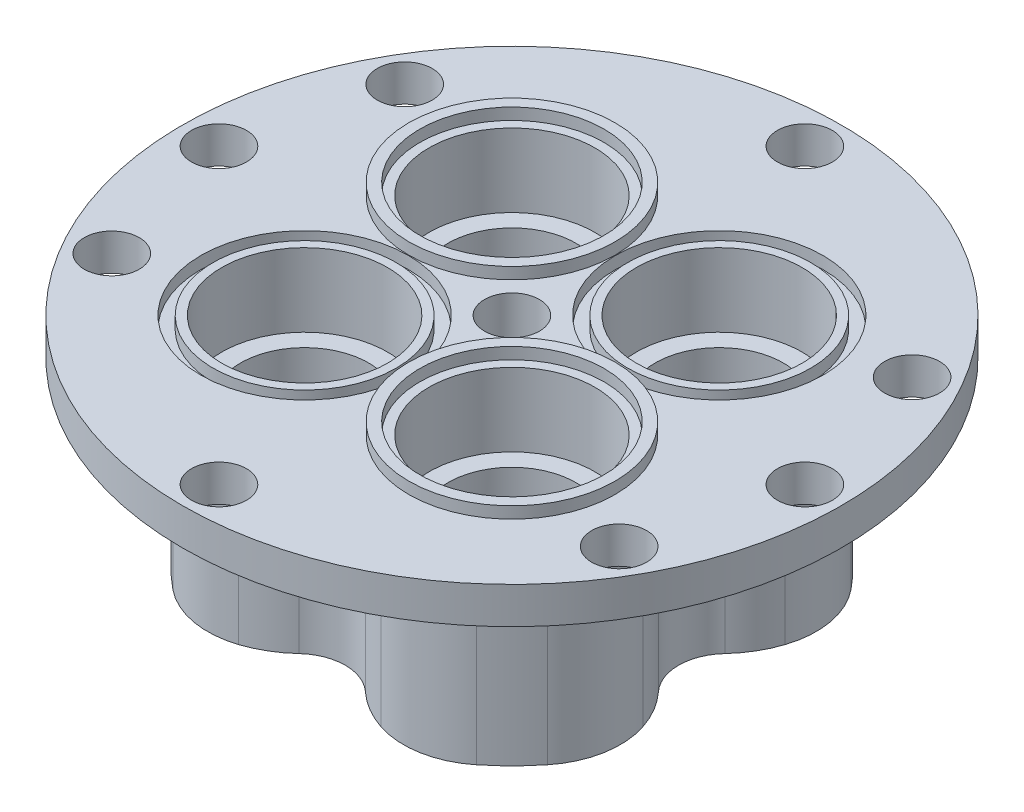
from build123d import *

# Parameters (mm, degrees)
SKETCH1_R                                        = 20.5
BOSS_EXTRUDE1_DEPTH                              = 18
SKETCH3_R                                        = 5.25
CUT_EXTRUDE1_M12_TAP_DRILL_DEPTH                 = 15
SKETCH4_R                                        = 6.7945
CUT_EXTRUDE2_RETAINING_RING_THREADS_DEPTH        = 6
CUT_EXTRUDE10_DEPTH                              = 35.124771062
CUT_EXTRUDE10_DEPTH_BACK                         = 9
SKETCH20_R                                       = 6
SKETCH7_R                                        = 8.45
SKETCH7_R_2                                      = 7.55
EXTRUDE_THIN1_DEPTH                              = 0.95
SKETCH8_R                                        = 8.5
SKETCH8_R_2                                      = 7.5
CUT_EXTRUDE_THIN1_DEPTH                          = 1
BOSS_EXTRUDE2_START                              = 3
SKETCH10_R                                       = 27
SKETCH10_R_2                                     = 20.5
BOSS_EXTRUDE2_DEPTH                              = 3
SKETCH11_R                                       = 2.25
CUT_EXTRUDE3_OLAF_MOUNTING_HOLES_M3_C_DEPTH      = 10
CUT_EXTRUDE9_BFG_MOUNTING_HOLES_M4_CL_DEPTH      = 43.627485265
CUT_EXTRUDE9_BFG_MOUNTING_HOLES_M4_CL_DEPTH_BACK = 43.627485265
SKETCH19_R                                       = 2.25
CUT_EXTRUDE5_DEPTH                               = 15
SKETCH16_R                                       = 26.810322774
SKETCH16_R_2                                     = 19.75
CUT_EXTRUDE6_FOR_BFG_FIT_DEPTH                   = 42.024382994
SKETCH12_R                                       = 2.25
CUT_EXTRUDE4_8_32_CLEARANCE_DEPTH                = 43.627485265
FILLET1_R                                        = 7


with BuildPart() as part:
    # Sketch1 → Boss-Extrude1 (new body)
    with BuildSketch(Plane(origin=(0, 0, 0), x_dir=(1, 0, 0), z_dir=(0, 1, 0))):
        with Locations(Location((0, 0, 0), (0, 0, 270))):
            Circle(SKETCH1_R)
    extrude(amount=BOSS_EXTRUDE1_DEPTH)

    # Sketch3 → Cut-Extrude1 (M12 tap drill) (cut)
    with BuildSketch(Plane(origin=(0, 18, 0), x_dir=(1, 0, 0), z_dir=(0, 1, 0))):
        with Locations(Location((-8.491378029, 8.491378029, 0), (0, 0, 270))):
            Circle(SKETCH3_R)
        with Locations(Location((8.491378029, 8.491378029, 0), (0, 0, 270))):
            Circle(SKETCH3_R)
        with Locations(Location((8.491378029, -8.491378029, 0), (0, 0, 270))):
            Circle(SKETCH3_R)
        with Locations(Location((-8.491378029, -8.491378029, 0), (0, 0, 270))):
            Circle(SKETCH3_R)
    extrude(amount=-CUT_EXTRUDE1_M12_TAP_DRILL_DEPTH, mode=Mode.SUBTRACT)

    # Sketch4 → Cut-Extrude2: retaining ring threads (cut)
    with BuildSketch(Plane(origin=(0, 18, 0), x_dir=(1, 0, 0), z_dir=(0, 1, 0))):
        with Locations(Location((-8.491378029, 8.491378029, 0), (0, 0, 270))):
            Circle(SKETCH4_R)
        with Locations(Location((8.491378029, 8.491378029, 0), (0, 0, 270))):
            Circle(SKETCH4_R)
        with Locations(Location((8.491378029, -8.491378029, 0), (0, 0, 270))):
            Circle(SKETCH4_R)
        with Locations(Location((-8.491378029, -8.491378029, 0), (0, 0, 270))):
            Circle(SKETCH4_R)
    extrude(amount=-CUT_EXTRUDE2_RETAINING_RING_THREADS_DEPTH, mode=Mode.SUBTRACT)

    # Sketch20 → Cut-Extrude10 (cut, two sides: drawn at the far end of the back side and taken through both)
    with BuildSketch(Plane.XZ.offset(-CUT_EXTRUDE10_DEPTH_BACK)):
        with Locations(Location((-8.491378029, 8.491378029, 0), (0, 0, 90))):
            Circle(SKETCH20_R)
        with Locations(Location((8.491378029, 8.491378029, 0), (0, 0, 90))):
            Circle(SKETCH20_R)
        with Locations(Location((8.491378029, -8.491378029, 0), (0, 0, 90))):
            Circle(SKETCH20_R)
        with Locations(Location((-8.491378029, -8.491378029, 0), (0, 0, 90))):
            Circle(SKETCH20_R)
    extrude(amount=CUT_EXTRUDE10_DEPTH + CUT_EXTRUDE10_DEPTH_BACK, mode=Mode.SUBTRACT)

    # Sketch7 → Extrude-Thin1 (add)
    # profile 1 of 2: a face of its own
    with BuildSketch(Plane(origin=(0, 18, 0), x_dir=(1, 0, 0), z_dir=(0, 1, 0))):
        with Locations((-8.491378029, 8.491378029)):
            Circle(SKETCH7_R)
        with Locations((-8.491378029, 8.491378029)):
            Circle(SKETCH7_R_2, mode=Mode.SUBTRACT)
    # profile 2 of 2: a face of its own
    with BuildSketch(Plane(origin=(0, 18, 0), x_dir=(1, 0, 0), z_dir=(0, 1, 0))):
        with Locations((8.491378029, -8.491378029)):
            Circle(SKETCH7_R)
        with Locations((8.491378029, -8.491378029)):
            Circle(SKETCH7_R_2, mode=Mode.SUBTRACT)
    extrude(amount=EXTRUDE_THIN1_DEPTH)

    # Sketch8 → Cut-Extrude-Thin1 (cut)
    # profile 1 of 2: a face of its own
    with BuildSketch(Plane(origin=(0, 18, 0), x_dir=(1, 0, 0), z_dir=(0, 1, 0))):
        with Locations((8.491378029, 8.491378029)):
            Circle(SKETCH8_R)
        with Locations((8.491378029, 8.491378029)):
            Circle(SKETCH8_R_2, mode=Mode.SUBTRACT)
    # profile 2 of 2: a face of its own
    with BuildSketch(Plane(origin=(0, 18, 0), x_dir=(1, 0, 0), z_dir=(0, 1, 0))):
        with Locations((-8.491378029, -8.491378029)):
            Circle(SKETCH8_R)
        with Locations((-8.491378029, -8.491378029)):
            Circle(SKETCH8_R_2, mode=Mode.SUBTRACT)
    extrude(amount=-CUT_EXTRUDE_THIN1_DEPTH, mode=Mode.SUBTRACT)

    # Sketch10 → Boss-Extrude2 (add)
    with BuildSketch(Plane.XZ.offset(-18).offset(BOSS_EXTRUDE2_START)):
        with Locations(Location((0, 0, 0), (0, 0, 90))):
            Circle(SKETCH10_R)
        with Locations(Location((0, 0, 0), (0, 0, 90))):
            Circle(SKETCH10_R_2, mode=Mode.SUBTRACT)
    extrude(amount=-BOSS_EXTRUDE2_DEPTH)

    # Sketch11 → Cut-Extrude3 (Olaf mounting holes >= M3 clearance) (cut)
    with BuildSketch(Plane(origin=(0, 18, 0), x_dir=(1, 0, 0), z_dir=(0, 1, 0))):
        with Locations(Location((0, 24, 0), (0, 0, 270))):
            Circle(SKETCH11_R)
        with Locations(Location((24, 0, 0), (0, 0, 270))):
            Circle(SKETCH11_R)
        with Locations(Location((0, -24, 0), (0, 0, 270))):
            Circle(SKETCH11_R)
        with Locations(Location((-24, 0, 0), (0, 0, 270))):
            Circle(SKETCH11_R)
    extrude(amount=-CUT_EXTRUDE3_OLAF_MOUNTING_HOLES_M3_C_DEPTH, mode=Mode.SUBTRACT)

    # Sketch19 → Cut-Extrude9 (BFG mounting holes - M4 clearance) (cut, two sides: drawn at the far end of the back side and taken through both)
    with BuildSketch(Plane(origin=(0, 0, 0), x_dir=(1, 0, 0), z_dir=(0, 1, 0)).offset(-CUT_EXTRUDE9_BFG_MOUNTING_HOLES_M4_CL_DEPTH_BACK)):
        with Locations(Location((0, 24, 0), (0, 0, 270))):
            Circle(SKETCH19_R)
        with Locations(Location((20.784609691, 12, 0), (0, 0, 270))):
            Circle(SKETCH19_R)
        with Locations(Location((20.784609691, -12, 0), (0, 0, 270))):
            Circle(SKETCH19_R)
        with Locations(Location((0, -24, 0), (0, 0, 270))):
            Circle(SKETCH19_R)
        with Locations(Location((-20.784609691, -12, 0), (0, 0, 270))):
            Circle(SKETCH19_R)
        with Locations(Location((-20.784609691, 12, 0), (0, 0, 270))):
            Circle(SKETCH19_R)
    extrude(amount=CUT_EXTRUDE9_BFG_MOUNTING_HOLES_M4_CL_DEPTH + CUT_EXTRUDE9_BFG_MOUNTING_HOLES_M4_CL_DEPTH_BACK, mode=Mode.SUBTRACT)

    # Sketch15 → Cut-Extrude5 (cut)
    with BuildSketch(Plane.XZ):
        with BuildLine():
            ThreePointArc((-14.495689014, 14.495689014), (-8.652435925, 16.981228509), (-2.719116501, 14.719098131))
            ThreePointArc((-2.719116501, 14.719098131), (0, 13.652765709), (2.719116501, 14.719098131))
            ThreePointArc((2.719116501, 14.719098131), (8.652435925, 16.981228509), (14.495689014, 14.495689014))
            ThreePointArc((14.495689014, 14.495689014), (0, 20.5), (-14.495689014, 14.495689014))
        make_face()
        with BuildLine():
            ThreePointArc((20.5, 0), (18.939530416, 7.845010363), (14.495689014, 14.495689014))
            ThreePointArc((14.495689014, 14.495689014), (16.981228509, 8.652435925), (14.719098131, 2.719116501))
            ThreePointArc((14.719098131, 2.719116501), (13.652765709, 0), (14.719098131, -2.719116501))
            ThreePointArc((14.719098131, -2.719116501), (16.981228509, -8.652435953), (14.495688975, -14.495689053))
            ThreePointArc((14.495688975, -14.495689053), (18.939530406, -7.845010389), (20.5, 0))
        make_face()
        with BuildLine():
            ThreePointArc((-14.719098131, 2.719116501), (-16.981228509, 8.652435925), (-14.495689014, 14.495689014))
            ThreePointArc((-14.495689014, 14.495689014), (-20.5, 0), (-14.495689014, -14.495689014))
            ThreePointArc((-14.495689014, -14.495689014), (-16.981228509, -8.652435925), (-14.719098131, -2.719116501))
            ThreePointArc((-14.719098131, -2.719116501), (-13.652765709, 0), (-14.719098131, 2.719116501))
        make_face()
        with BuildLine():
            ThreePointArc((-2.719116501, -14.719098131), (-8.652435925, -16.981228509), (-14.495689014, -14.495689014))
            ThreePointArc((-14.495689014, -14.495689014), (-2.7e-08, -20.5), (14.495688975, -14.495689053))
            ThreePointArc((14.495688975, -14.495689053), (8.652435898, -16.98122851), (2.719116501, -14.719098131))
            ThreePointArc((2.719116501, -14.719098131), (0, -13.652765709), (-2.719116501, -14.719098131))
        make_face()
    extrude(amount=-CUT_EXTRUDE5_DEPTH, mode=Mode.SUBTRACT)

    # Sketch16 → Cut-Extrude6 (for BFG fit) (cut, through all)
    with BuildSketch(Plane.XZ.offset(-15)):
        Circle(SKETCH16_R)
        Circle(SKETCH16_R_2, mode=Mode.SUBTRACT)
    extrude(amount=CUT_EXTRUDE6_FOR_BFG_FIT_DEPTH, mode=Mode.SUBTRACT)

    # Sketch12 → Cut-Extrude4 ("8-32 clearance") (cut, through all)
    with BuildSketch(Plane.XZ):
        with Locations(Location((0, 0, 0), (0, 0, 270))):
            Circle(SKETCH12_R)
    extrude(amount=-CUT_EXTRUDE4_8_32_CLEARANCE_DEPTH, mode=Mode.SUBTRACT)

    # Fillet1
    fillet1_edges = [part.edges().sort_by_distance(p)[0] for p in [
        (10.463198747, 7.5, 16.750640943),
        (16.750640943, 7.5, 10.463198747),
        (10.463198747, 7.5, -16.750640943),
        (-10.463198747, 7.5, -16.750640943),
        (16.750640943, 7.5, -10.463198747),
        (-16.750640943, 7.5, -10.463198747),
        (-16.750640943, 7.5, 10.463198747),
        (-10.463198747, 7.5, 16.750640943),
    ]]
    fillet(fillet1_edges, radius=FILLET1_R)


solid = part.part
